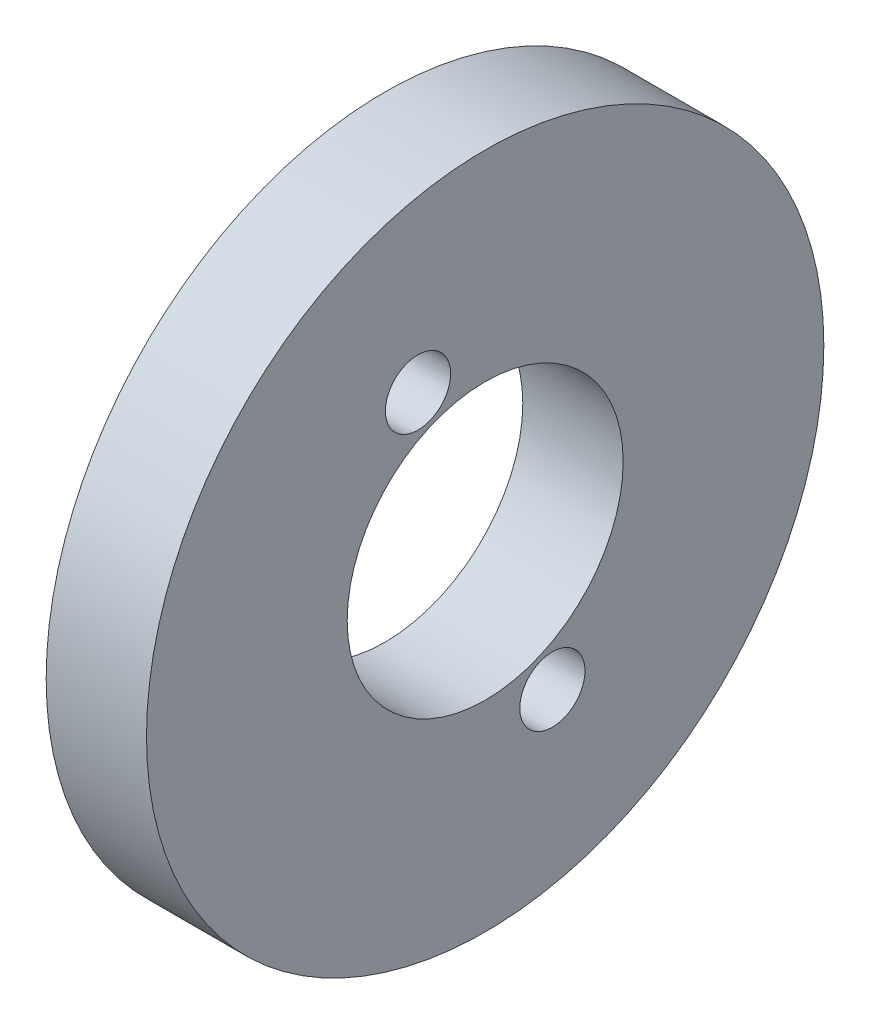
from build123d import *

# Parameters (mm, degrees)
AXIAL_PROFILE_MM_W     = 8
AXIAL_PROFILE_MM_H     = 16
AXIAL_HOLES_DEPTH      = 149.686549493
AXIAL_HOLES_DEPTH_BACK = 149.686549493
SKETCH2_R              = 2.6


with BuildPart() as part:
    # Axial profile (mm) → Full revolution (revolve)
    with BuildSketch(Plane.XY, mode=Mode.PRIVATE) as full_revolution_sk:
        with Locations((139.7, 19)):
            Rectangle(AXIAL_PROFILE_MM_W, AXIAL_PROFILE_MM_H)
    revolve(full_revolution_sk.sketch.rotate(Axis((-110, 0, 0), (1, 0, 0)), 90), axis=Axis((-110, 0, 0), (1, 0, 0)))

    # Sketch2 → Axial holes (cut, two sides: drawn at the far end of the back side and taken through both)
    with BuildSketch(Plane(origin=(0, 0, 0), x_dir=(0, 0, -1), z_dir=(1, 0, 0)).offset(-AXIAL_HOLES_DEPTH_BACK)):
        with Locations((-5.357568053, 12.934313455)):
            Circle(SKETCH2_R)
        with Locations((5.357568053, -12.934313455)):
            Circle(SKETCH2_R)
    extrude(amount=AXIAL_HOLES_DEPTH + AXIAL_HOLES_DEPTH_BACK, mode=Mode.SUBTRACT)


solid = part.part
